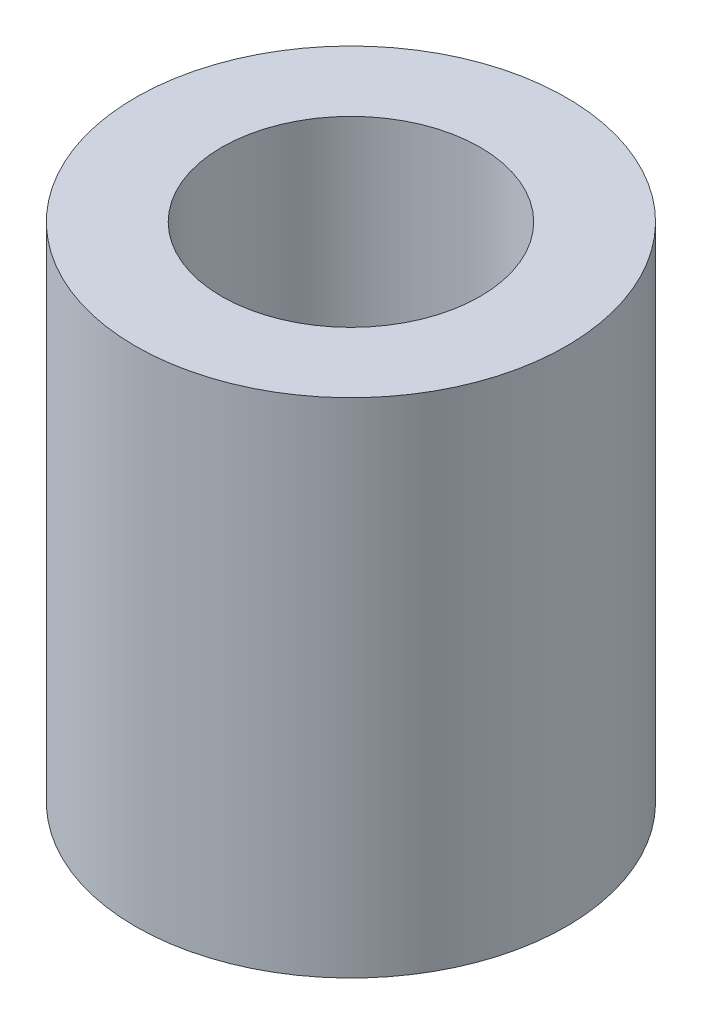
from build123d import *

# Parameters (mm, degrees)
SKETCH_1_R      = 3
SKETCH_1_R_2    = 1.8
EXTRUDE_1_DEPTH = 7


with BuildPart() as part:
    # 草图1 → 凸台-拉伸1 (new body)
    with BuildSketch(Plane(origin=(0, 0, 0), x_dir=(1, 0, 0), z_dir=(0, 1, 0))):
        with Locations(Location((0, 0, 0), (0, 0, 270))):
            Circle(SKETCH_1_R)
        with Locations(Location((0, 0, 0), (0, 0, 270))):
            Circle(SKETCH_1_R_2, mode=Mode.SUBTRACT)
    extrude(amount=EXTRUDE_1_DEPTH)


solid = part.part
